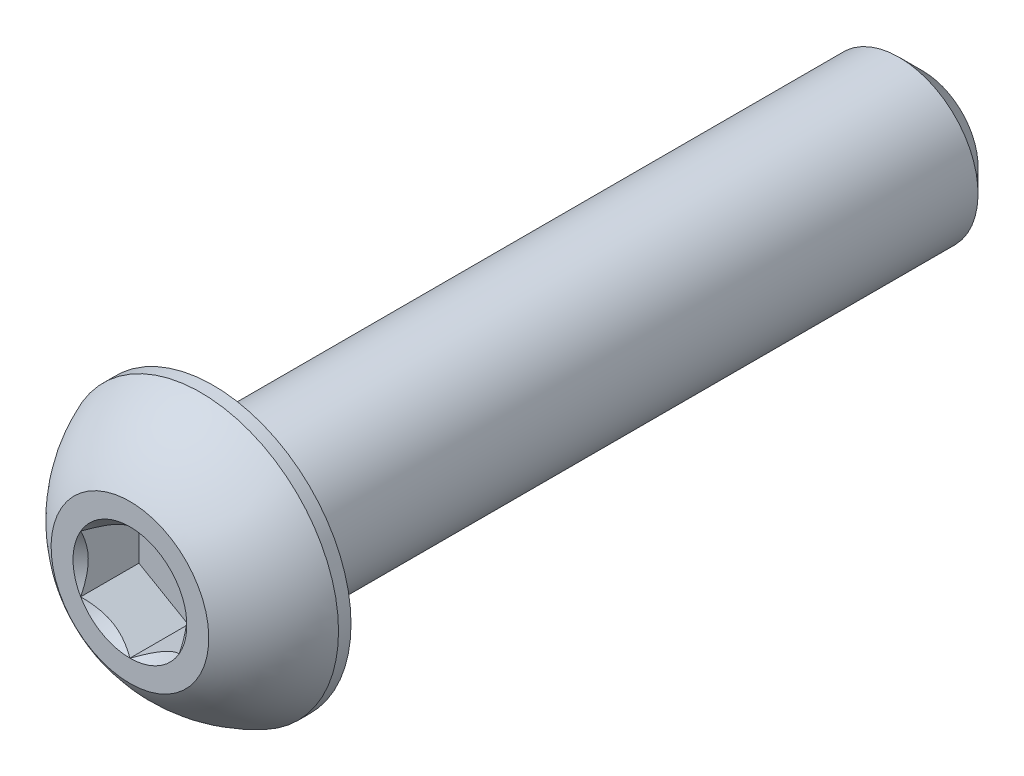
from build123d import *

# Parameters (mm, degrees)
SKETCH1_W          = 28.575
SKETCH1_H          = 3.175
CHAMFER1_SIZE      = 0.9525
CUT_EXTRUDE2_DEPTH = 2.34696


with BuildPart() as part:
    # Sketch1 → Revolve1 (revolve)
    with BuildSketch(Plane(origin=(0, 0, 0), x_dir=(0, 0, -1), z_dir=(1, 0, 0))):
        with Locations((17.6403, 1.5875)):
            Rectangle(SKETCH1_W, SKETCH1_H)
    revolve(axis=Axis((0, 0, -31.9278), (0, 0, 1)))

    # Chamfer1
    chamfer1_edges = [part.edges().sort_by_distance(p)[0] for p in [
        (0, -3.175, -31.9278),
    ]]
    chamfer(chamfer1_edges, length=CHAMFER1_SIZE)

    # Sketch7 → Revolve2 (revolve)
    with BuildSketch(Plane(origin=(0, 0, 0), x_dir=(0, 0, -1), z_dir=(1, 0, 0))):
        with BuildLine():
            Line((2.84988, 5.5499), (3.3528, 5.5499))
            Line((3.3528, 5.5499), (3.3528, 0))
            Line((3.3528, 0), (0, 0))
            Line((0, 0), (0, 3.175))
            ThreePointArc((0, 3.175), (1.235921075, 4.58927271), (2.84988, 5.5499))
        make_face()
    revolve(axis=Axis((0, 0, 0), (0, 0, -1)))

    # Sketch5 → Cut-Extrude2 (cut)
    with BuildSketch(Plane.XY):
        Polygon((1.984375, -1.14567944), (1.984375, 1.14567944), (0, 2.291358881), (-1.984375, 1.14567944), (-1.984375, -1.14567944), (0, -2.291358881), align=None)
    extrude(amount=-CUT_EXTRUDE2_DEPTH, mode=Mode.SUBTRACT)

    # Cut-Extrude3 cone 1 section (through the dimple's axis) → Cut-Extrude3 (revolve, cut)
    with BuildSketch(Plane(origin=(0, 0, 0), x_dir=(0, -1, 0), z_dir=(1, 0, 0))):
        Polygon((0, 0), (2.291358881, 0), (0, 2.291358881), align=None)
    revolve(axis=Axis((0, 0, 0), (0, 0, -1)), mode=Mode.SUBTRACT)


solid = part.part
